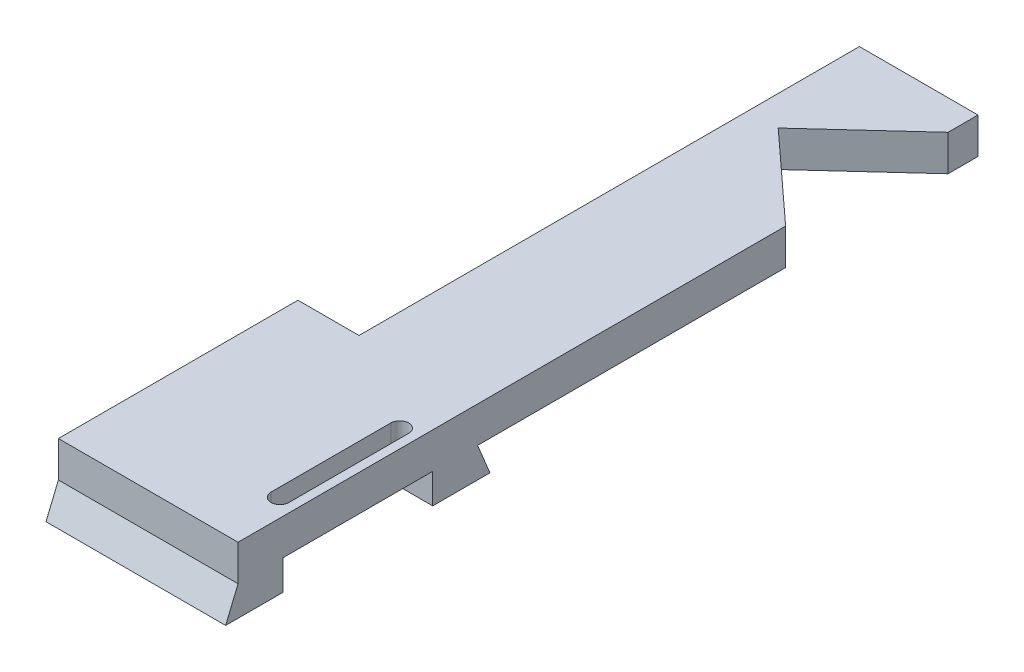
from build123d import *

# Parameters (mm, degrees)
BOSS_EXTRUDE1_DEPTH        = 6
BOSS_EXTRUDE6_DEPTH        = 30
DOVE_BOSS_DEPTH            = 30
PIN_SLOT_REACH             = 39.724
PIN_SLOT_DIRECTION_2_DEPTH = 38.723710458
BOSS_EXTRUDE8_DEPTH        = 6


with BuildPart() as part:
    # Sketch1 → Boss-Extrude1 (new body)
    with BuildSketch(Plane(origin=(0, 0, 0), x_dir=(1, 0, 0), z_dir=(0, 1, 0))):
        Polygon((-30, 20), (-30, -20), (0, -20), (0, -8.167550091), (-6.853388269, 0), (0, 8.167550091), (0, 20), align=None)
        Polygon((-6.853388269, 0), (0, -8.167550091), (0, 8.167550091), align=None)
    extrude(amount=BOSS_EXTRUDE1_DEPTH)

    # Sketch7 → Boss-Extrude6 (add)
    with BuildSketch(Plane(origin=(-30, 0, 0), x_dir=(0, 0, -1), z_dir=(1, 0, 0))):
        Polygon((-12.5, 0), (-20, 0), (-22.069851171, -5), (-12.5, -5), align=None)
    extrude(amount=BOSS_EXTRUDE6_DEPTH)

    # Sketch7<3> → Dove Boss (add)
    with BuildSketch(Plane(origin=(-30, 0, 0), x_dir=(0, 0, -1), z_dir=(1, 0, 0))):
        Polygon((20, 0), (12.5, 0), (12.5, -5), (22.069851171, -5), align=None)
    extrude(amount=DOVE_BOSS_DEPTH)

    # Sketch4 → Pin Slot (cut, up to next)
    with BuildSketch(Plane(origin=(0, 0, 0), x_dir=(1, 0, 0), z_dir=(0, 1, 0)), mode=Mode.PRIVATE) as pin_slot_sk1:
        with BuildLine():
            Line((-1.5, 10), (-1.5, -10))
            ThreePointArc((-1.5, -10), (-3, -11.5), (-4.5, -10))
            Line((-4.5, -10), (-4.5, 10))
            ThreePointArc((-4.5, 10), (-3, 11.5), (-1.5, 10))
        make_face()
    pin_slot_tool1 = extrude(pin_slot_sk1.sketch, amount=PIN_SLOT_REACH, mode=Mode.PRIVATE) & part.part
    add(pin_slot_tool1.solids().sort_by_distance((-3, 0, 0))[0], mode=Mode.SUBTRACT)

    # Sketch4 → Pin Slot direction 2 (cut)
    with BuildSketch(Plane(origin=(0, 0, 0), x_dir=(1, 0, 0), z_dir=(0, 1, 0))):
        with BuildLine():
            Line((-1.5, 10), (-1.5, -10))
            ThreePointArc((-1.5, -10), (-3, -11.5), (-4.5, -10))
            Line((-4.5, -10), (-4.5, 10))
            ThreePointArc((-4.5, 10), (-3, 11.5), (-1.5, 10))
        make_face()
    extrude(amount=-PIN_SLOT_DIRECTION_2_DEPTH, mode=Mode.SUBTRACT)

    # Sketch8 → Boss-Extrude8 (add)
    with BuildSketch(Plane(origin=(0, 6, 0), x_dir=(1, 0, 0), z_dir=(0, 1, 0))):
        Polygon((0, 71.436582951), (-14.801872329, 85), (0, 98.563417049), (0, 103.563417049), (-19.801872329, 103.563417049), (-19.801872329, 20), (0, 20), align=None)
    extrude(amount=-BOSS_EXTRUDE8_DEPTH)


solid = part.part
